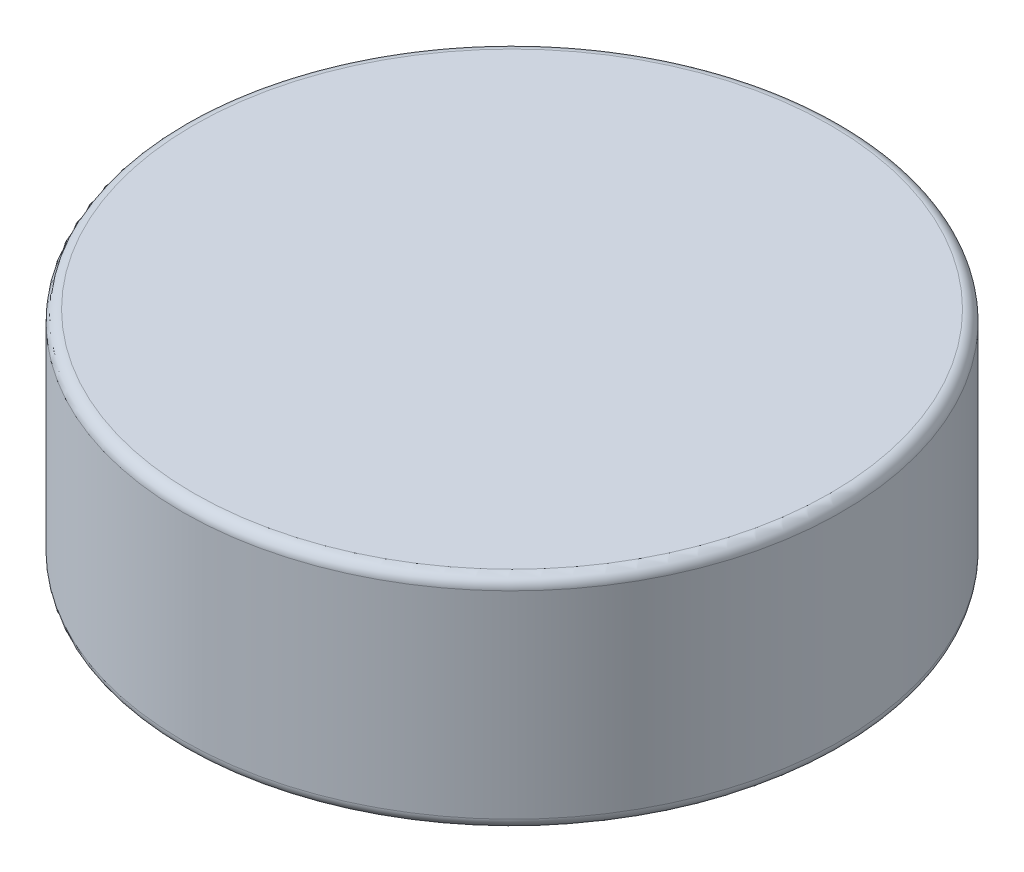
from build123d import *

# Parameters (mm, degrees)
SKETCH_1_R      = 3
EXTRUDE_1_DEPTH = 2
FILLET_1_R      = 0.1


with BuildPart() as part:
    # 草图1 → 凸台-拉伸1 (new body)
    with BuildSketch(Plane(origin=(0, 0, 0), x_dir=(1, 0, 0), z_dir=(0, 1, 0))):
        with Locations(Location((0, 0, 0), (0, 0, 270))):
            Circle(SKETCH_1_R)
    extrude(amount=EXTRUDE_1_DEPTH)

    # 圆角1
    fillet_1_edges = [part.edges().sort_by_distance(p)[0] for p in [
        (0, 0, -3),
        (0, 2, -3),
    ]]
    fillet(fillet_1_edges, radius=FILLET_1_R)


solid = part.part
